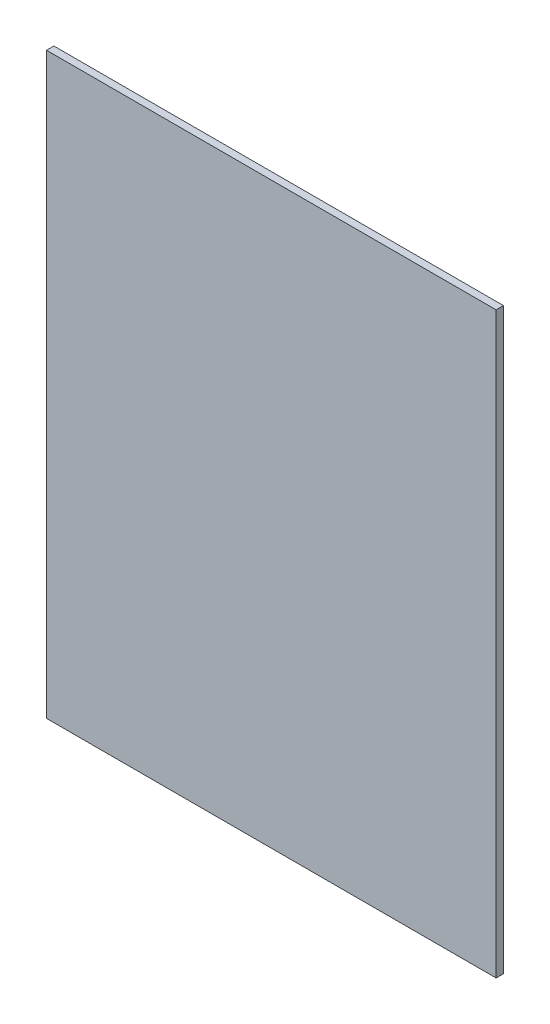
from build123d import *

# Parameters (mm, degrees)
SKETCH2_W           = 730.25
SKETCH2_H           = 939.8
BOSS_EXTRUDE1_DEPTH = 11.938


with BuildPart() as part:
    # Sketch2 → Boss-Extrude1 (new body)
    with BuildSketch(Plane.XY):
        with Locations((-365.125, 469.9)):
            Rectangle(SKETCH2_W, SKETCH2_H)
    extrude(amount=BOSS_EXTRUDE1_DEPTH)


solid = part.part
